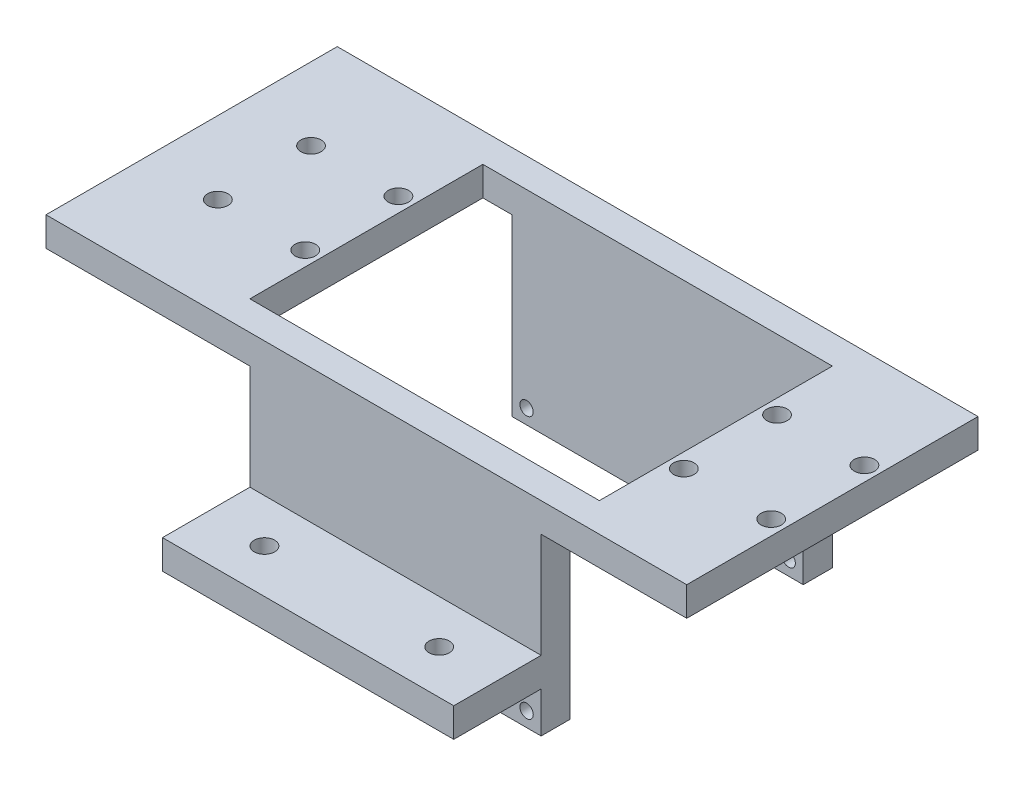
from build123d import *

# Parameters (mm, degrees)
SKETCH3_W               = 100
SKETCH3_H               = 50
SKETCH3_R               = 1.75
BOSS_EXTRUDE1_DEPTH     = 5
CUT_EXTRUDE1_DEPTH      = 57.124860802
CUT_EXTRUDE1_DEPTH_BACK = 57.124860802
SKETCH4_W               = 60
SKETCH4_H               = 40
SKETCH5_W               = 50
SKETCH5_H               = 5
BOSS_EXTRUDE2_DEPTH     = 30
SKETCH6_W               = 50
SKETCH6_H               = 5
BOSS_EXTRUDE3_DEPTH     = 15
SKETCH7_R               = 1.75
CUT_EXTRUDE2_DEPTH      = 69.036754773
SKETCH8_R               = 1.15
CUT_EXTRUDE3_DEPTH      = 88.321245983
SKETCH9_W               = 50
SKETCH9_H               = 5
BOSS_EXTRUDE4_DEPTH     = 10


with BuildPart() as part:
    # Sketch3 → Boss-Extrude1 (new body)
    with BuildSketch(Plane(origin=(0, 0, 0), x_dir=(1, 0, 0), z_dir=(0, 1, 0))):
        Rectangle(SKETCH3_W, SKETCH3_H)
        with Locations(Location((-47.5, 8, 0), (0, 0, 270))):
            Circle(SKETCH3_R, mode=Mode.SUBTRACT)
        with Locations(Location((-32.5, 8, 0), (0, 0, 270))):
            Circle(SKETCH3_R, mode=Mode.SUBTRACT)
        with Locations(Location((-47.5, -8, 0), (0, 0, 270))):
            Circle(SKETCH3_R, mode=Mode.SUBTRACT)
        with Locations(Location((-32.5, -8, 0), (0, 0, 270))):
            Circle(SKETCH3_R, mode=Mode.SUBTRACT)
        with Locations(Location((47.5, -8, 0), (0, 0, 90))):
            Circle(SKETCH3_R, mode=Mode.SUBTRACT)
        with Locations(Location((47.5, 8, 0), (0, 0, 90))):
            Circle(SKETCH3_R, mode=Mode.SUBTRACT)
        with Locations(Location((32.5, 8, 0), (0, 0, 90))):
            Circle(SKETCH3_R, mode=Mode.SUBTRACT)
        with Locations(Location((32.5, -8, 0), (0, 0, 90))):
            Circle(SKETCH3_R, mode=Mode.SUBTRACT)
    extrude(amount=BOSS_EXTRUDE1_DEPTH)

    # Sketch4 → Cut-Extrude1 (cut, two sides: drawn at the far end of the back side and taken through both)
    with BuildSketch(Plane(origin=(0, 5, 0), x_dir=(1, 0, 0), z_dir=(0, 1, 0)).offset(-CUT_EXTRUDE1_DEPTH_BACK)):
        Rectangle(SKETCH4_W, SKETCH4_H)
    extrude(amount=CUT_EXTRUDE1_DEPTH + CUT_EXTRUDE1_DEPTH_BACK, mode=Mode.SUBTRACT)

    # Sketch5 → Boss-Extrude2 (add)
    with BuildSketch(Plane(origin=(0, 0, 0), x_dir=(1, 0, 0), z_dir=(0, 1, 0))):
        with Locations((0, 22.5)):
            Rectangle(SKETCH5_W, SKETCH5_H)
        with Locations((0, -22.5)):
            Rectangle(SKETCH5_W, SKETCH5_H)
    extrude(amount=-BOSS_EXTRUDE2_DEPTH)

    # Sketch6 → Boss-Extrude3 (add)
    with BuildSketch(Plane.XY.offset(25)):
        with Locations((0, -20.5)):
            Rectangle(SKETCH6_W, SKETCH6_H)
    boss_extrude3 = extrude(amount=BOSS_EXTRUDE3_DEPTH)

    # Sketch7 → Cut-Extrude2 (cut, through all)
    with BuildSketch(Plane(origin=(0, -18, 0), x_dir=(1, 0, 0), z_dir=(0, 1, 0))):
        with Locations(Location((-15, -32.5, 0), (0, 0, 270))):
            Circle(SKETCH7_R)
        with Locations(Location((15, -32.5, 0), (0, 0, 270))):
            Circle(SKETCH7_R)
    cut_extrude2 = extrude(amount=-CUT_EXTRUDE2_DEPTH, mode=Mode.SUBTRACT)

    # Mirror1: Boss-Extrude3, Cut-Extrude2 across plane
    add(boss_extrude3.mirror(Plane.XY))
    add(cut_extrude2.mirror(Plane.XY), mode=Mode.SUBTRACT)

    # Sketch8 → Cut-Extrude3 (cut, through all)
    with BuildSketch(Plane.XY.offset(25)):
        with Locations((-22.5, -27.5)):
            Circle(SKETCH8_R)
        with Locations((22.5, -27.5)):
            Circle(SKETCH8_R)
    extrude(amount=-CUT_EXTRUDE3_DEPTH, mode=Mode.SUBTRACT)

    # Sketch9 → Boss-Extrude4 (add)
    with BuildSketch(Plane.ZY.offset(50)):
        with Locations((0, 2.5)):
            Rectangle(SKETCH9_W, SKETCH9_H)
    extrude(amount=BOSS_EXTRUDE4_DEPTH)


solid = part.part
